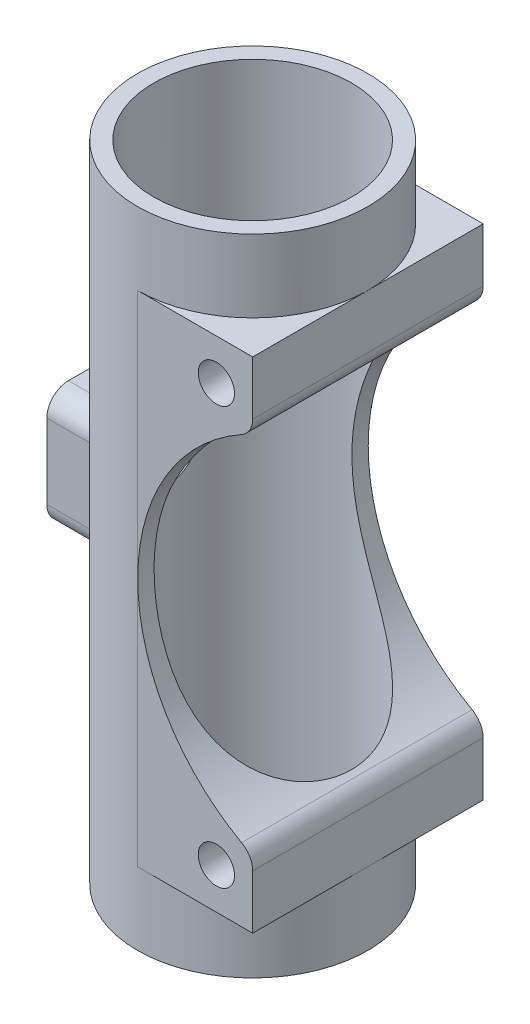
from build123d import *

# Parameters (mm, degrees)
SKETCH1_R                = 12.7
SKETCH1_R_2              = 10.9
BOSS_EXTRUDE1_DEPTH      = 71
BOSS_EXTRUDE2_DEPTH      = 63
CUT_EXTRUDE1_DEPTH       = 8
CUT_EXTRUDE2_DEPTH       = 15
CUT_EXTRUDE2_DEPTH_BACK  = 16
SKETCH4_R                = 22.297733005
SKETCH5_R                = 2
CUT_EXTRUDE3_DEPTH       = 4
CUT_EXTRUDE4_START       = -4
SKETCH6_R                = 2
CUT_EXTRUDE4_DEPTH       = 4
BOSS_EXTRUDE3_DEPTH      = 6.5
BOSS_EXTRUDE3_DEPTH_BACK = 6.5
SKETCH15_R               = 4
CUT_EXTRUDE14_DEPTH      = 7.5
BOSS_EXTRUDE4_START      = 1.75
SKETCH16_W               = 13
SKETCH16_H               = 13
SKETCH16_R               = 4
BOSS_EXTRUDE4_DEPTH      = 1.75
FILLET1_R                = 2.38
FILLET2_R                = 2.38


with BuildPart() as part:
    # Sketch1 → Boss-Extrude1 (new body)
    with BuildSketch(Plane(origin=(0, 0, 0), x_dir=(1, 0, 0), z_dir=(0, 1, 0))):
        with Locations(Location((0, 0, 0), (0, 0, 270))):
            Circle(SKETCH1_R)
        with Locations(Location((0, 0, 0), (0, 0, 270))):
            Circle(SKETCH1_R_2, mode=Mode.SUBTRACT)
    extrude(amount=BOSS_EXTRUDE1_DEPTH)

    # Sketch2 → Boss-Extrude2 (add)
    with BuildSketch(Plane.XZ):
        with BuildLine():
            Line((12.7, 12.7), (0, 12.7))
            ThreePointArc((0, 12.7), (8.980256121, 8.980256121), (12.7, 0))
            Line((12.7, 0), (12.7, 12.7))
        make_face()
        with BuildLine():
            Line((12.7, -12.7), (12.7, 0))
            ThreePointArc((12.7, 0), (8.980256121, -8.980256121), (0, -12.7))
            Line((0, -12.7), (12.7, -12.7))
        make_face()
    extrude(amount=-BOSS_EXTRUDE2_DEPTH)

    # Sketch3 → Cut-Extrude1 (cut)
    with BuildSketch(Plane.XZ):
        with BuildLine():
            Line((12.7, 12.7), (0, 12.7))
            ThreePointArc((0, 12.7), (8.980256109, 8.980256133), (12.7, 3.4e-08))
            Line((12.7, 3.4e-08), (12.7, 12.7))
        make_face()
        with BuildLine():
            Line((12.7, -12.7), (12.7, 3.4e-08))
            ThreePointArc((12.7, 3.4e-08), (8.980256133, -8.980256109), (0, -12.7))
            Line((0, -12.7), (12.7, -12.7))
        make_face()
    extrude(amount=-CUT_EXTRUDE1_DEPTH, mode=Mode.SUBTRACT)

    # Sketch4 → Cut-Extrude2 (cut, two sides: drawn at the far end of the back side and taken through both)
    with BuildSketch(Plane.XY.offset(-CUT_EXTRUDE2_DEPTH_BACK)):
        with Locations((22.331187996, 35.5)):
            Circle(SKETCH4_R)
    extrude(amount=CUT_EXTRUDE2_DEPTH + CUT_EXTRUDE2_DEPTH_BACK, mode=Mode.SUBTRACT)

    # Sketch5 → Cut-Extrude3 (cut)
    with BuildSketch(Plane(origin=(0, 0, -12.7), x_dir=(-1, 0, 0), z_dir=(0, 0, -1))):
        with Locations((-8.7, 58.5)):
            Circle(SKETCH5_R)
        with Locations((-8.7, 12.5)):
            Circle(SKETCH5_R)
    extrude(amount=-CUT_EXTRUDE3_DEPTH, mode=Mode.SUBTRACT)

    # Sketch6 → Cut-Extrude4 (cut)
    with BuildSketch(Plane.XY.offset(12.7).offset(CUT_EXTRUDE4_START)):
        with Locations(Location((8.7, 58.5, 0), (0, 0, 180))):
            Circle(SKETCH6_R)
        with Locations(Location((8.7, 12.5, 0), (0, 0, 180))):
            Circle(SKETCH6_R)
    extrude(amount=CUT_EXTRUDE4_DEPTH, mode=Mode.SUBTRACT)

    # Sketch14 → Boss-Extrude3 (add, two sides: drawn at the far end of the back side and taken through both)
    with BuildSketch(Plane(origin=(0, 35.5, 0), x_dir=(1, 0, 0), z_dir=(0, 1, 0)).offset(-BOSS_EXTRUDE3_DEPTH_BACK)):
        with BuildLine():
            Line((-14.4365, -6.5), (-14.4365, 6.5))
            Line((-14.4365, 6.5), (-10.836564596, 6.5))
            ThreePointArc((-10.836564596, 6.5), (-12.6365, 0), (-10.836564596, -6.5))
            Line((-10.836564596, -6.5), (-14.4365, -6.5))
        make_face()
    extrude(amount=BOSS_EXTRUDE3_DEPTH + BOSS_EXTRUDE3_DEPTH_BACK)

    # Sketch15 → Cut-Extrude14 (cut)
    with BuildSketch(Plane.ZY.offset(14.4365)):
        with Locations((0, 35.5)):
            Circle(SKETCH15_R)
    extrude(amount=-CUT_EXTRUDE14_DEPTH, mode=Mode.SUBTRACT)

    # Sketch16 → Boss-Extrude4 (add)
    with BuildSketch(Plane.ZY.offset(14.4365).offset(BOSS_EXTRUDE4_START)):
        with Locations((0, 35.5)):
            Rectangle(SKETCH16_W, SKETCH16_H)
        with Locations((0, 35.5)):
            Circle(SKETCH16_R, mode=Mode.SUBTRACT)
    extrude(amount=-BOSS_EXTRUDE4_DEPTH)

    # Fillet1
    fillet1_edges = [part.edges().sort_by_distance(p)[0] for p in [
        (-13.548522679, 29, 6.5),
        (-13.548522679, 29, -6.5),
        (-13.548522679, 42, -6.5),
        (-13.548522679, 42, 6.5),
    ]]
    fillet(fillet1_edges, radius=FILLET1_R)

    # Fillet2
    fillet2_edges = [part.edges().sort_by_distance(p)[0] for p in [
        (12.7, 15.389576958, 0),
        (12.7, 55.610423042, 0),
    ]]
    fillet(fillet2_edges, radius=FILLET2_R)


solid = part.part
